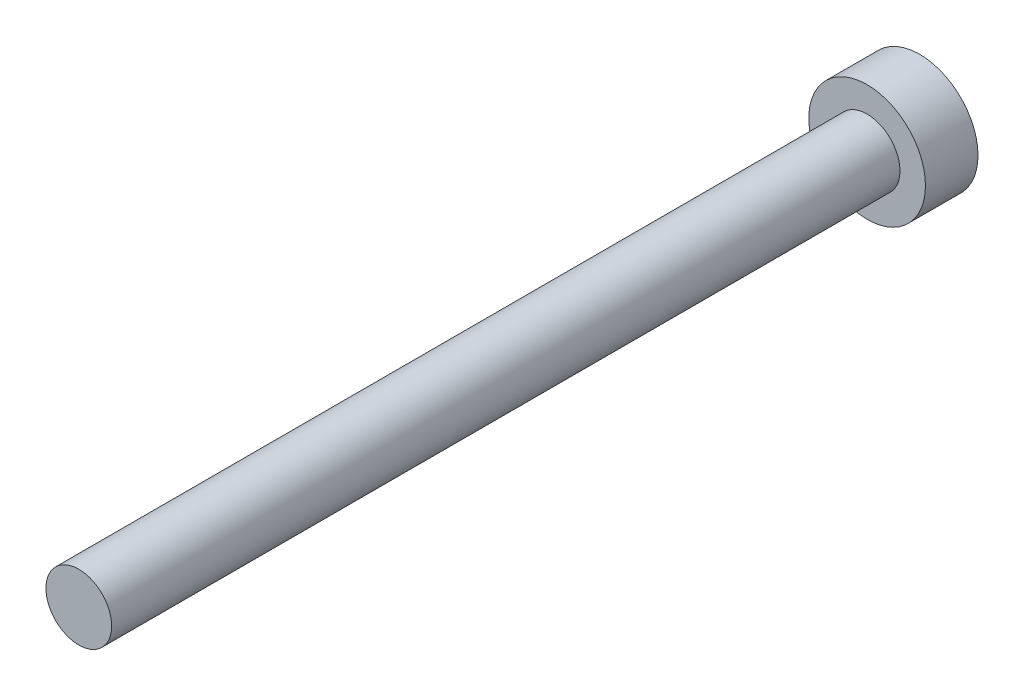
from build123d import *

# Parameters (mm, degrees)
SKETCH2_R           = 1.25
BOSS_EXTRUDE1_DEPTH = 30
SKETCH3_R           = 2.22
BOSS_EXTRUDE2_DEPTH = 2


with BuildPart() as part:
    # Sketch2 → Boss-Extrude1 (new body)
    with BuildSketch(Plane.XY):
        Circle(SKETCH2_R)
    extrude(amount=BOSS_EXTRUDE1_DEPTH)

    # Sketch3 → Boss-Extrude2 (add)
    with BuildSketch(Plane.XY):
        Circle(SKETCH3_R)
    extrude(amount=-BOSS_EXTRUDE2_DEPTH)


solid = part.part
